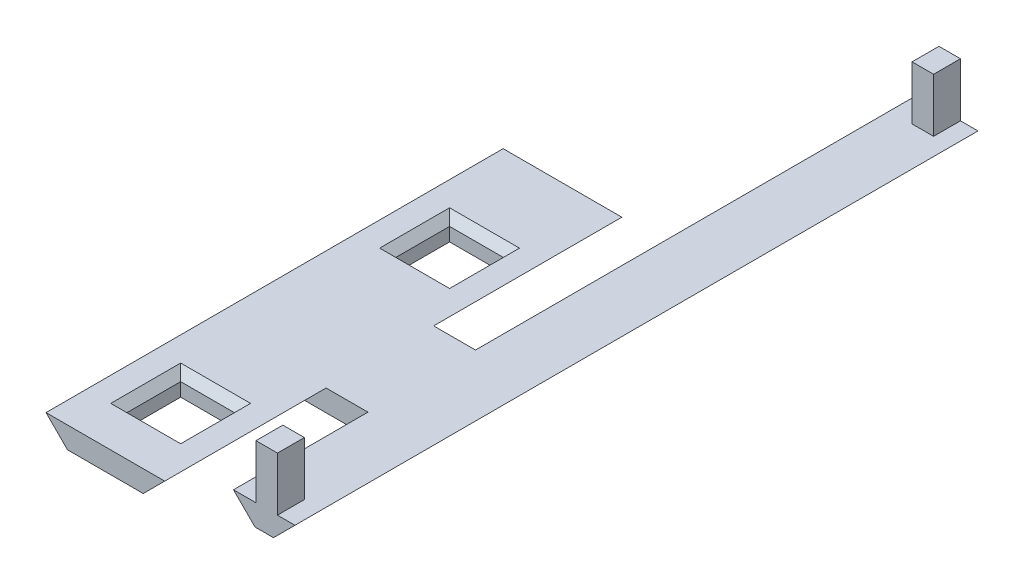
from build123d import *

# Parameters (mm, degrees)
DODANIE_WYCI_GNI_CIE1_DEPTH      = 85
SZKIC2_W                         = 10
SZKIC2_H                         = 10
WYTNIJ_WYCI_GNI_CIE1_DEPTH       = 80
DODANIE_WYCI_GNI_CIE3_DEPTH      = 80
DODANIE_WYCI_GNI_CIE3_DEPTH_BACK = 47
SZKIC4_W                         = 15.782842712
SZKIC4_H                         = 20
DODANIE_WYCI_GNI_CIE4_DEPTH      = 4
SZKIC5_W                         = 4
SZKIC5_H                         = 5
DODANIE_WYCI_GNI_CIE5_DEPTH      = 10
SZKIC6_W                         = 4
SZKIC6_H                         = 5
DODANIE_WYCI_GNI_CIE6_DEPTH      = 10
SFAZOWANIE1_SIZE                 = 1.5


with BuildPart() as part:
    # Szkic1 → Dodanie-wyciągnięcie1 (new body)
    with BuildSketch(Plane.XY):
        Polygon((7.5, 0), (11.5, 4), (-10.578691808, 4), (-6.578691808, 0), align=None)
    extrude(amount=DODANIE_WYCI_GNI_CIE1_DEPTH)

    # Szkic2 → Wytnij-wyciągnięcie1 (cut)
    with BuildSketch(Plane.XZ):
        with Locations((0.460654096, 21)):
            Rectangle(SZKIC2_W, SZKIC2_H)
        with Locations((0.460654096, 71)):
            Rectangle(SZKIC2_W, SZKIC2_H)
    extrude(amount=-WYTNIJ_WYCI_GNI_CIE1_DEPTH, mode=Mode.SUBTRACT)



with BuildPart() as body_2:
    # Szkic1<4> → Dodanie-wyciągnięcie3 (new, two sides: drawn at the far end of the back side and taken through both)
    with BuildSketch(Plane.XY.offset(-DODANIE_WYCI_GNI_CIE3_DEPTH_BACK)):
        Polygon((19.282842712, 4), (23.282842712, 0), (26.717157288, 0), (30.717157288, 4), align=None)
    extrude(amount=DODANIE_WYCI_GNI_CIE3_DEPTH + DODANIE_WYCI_GNI_CIE3_DEPTH_BACK)


with BuildPart() as part_1:
    add(part.part)

    add(body_2.part)  # Dodanie-wyciągnięcie4 merges body 2
    # Szkic4 → Dodanie-wyciągnięcie4 (add)
    with BuildSketch(Plane.XZ):
        with Locations((15.391421356, 45)):
            Rectangle(SZKIC4_W, SZKIC4_H)
    extrude(amount=-DODANIE_WYCI_GNI_CIE4_DEPTH)

    # Szkic5 → Dodanie-wyciągnięcie5 (add)
    with BuildSketch(Plane(origin=(0, 4, 0), x_dir=(1, 0, 0), z_dir=(0, 1, 0))):
        with Locations((25.460654096, -77.5)):
            Rectangle(SZKIC5_W, SZKIC5_H)
    extrude(amount=DODANIE_WYCI_GNI_CIE5_DEPTH)

    # Szkic6 → Dodanie-wyciągnięcie6 (add)
    with BuildSketch(Plane(origin=(0, 4, 0), x_dir=(1, 0, 0), z_dir=(0, 1, 0))):
        with Locations((25.460654096, 44.5)):
            Rectangle(SZKIC6_W, SZKIC6_H)
    extrude(amount=DODANIE_WYCI_GNI_CIE6_DEPTH)

    # Sfazowanie1
    sfazowanie1_edges = [part_1.edges().sort_by_distance(p)[0] for p in [
        (0.460654096, 4, 76),
        (-4.539345904, 4, 71),
        (0.460654096, 4, 66),
        (5.460654096, 4, 71),
        (0.460654096, 4, 26),
        (-4.539345904, 4, 21),
        (0.460654096, 4, 16),
        (5.460654096, 4, 21),
    ]]
    chamfer(sfazowanie1_edges, length=SFAZOWANIE1_SIZE)


solid = part_1.part
